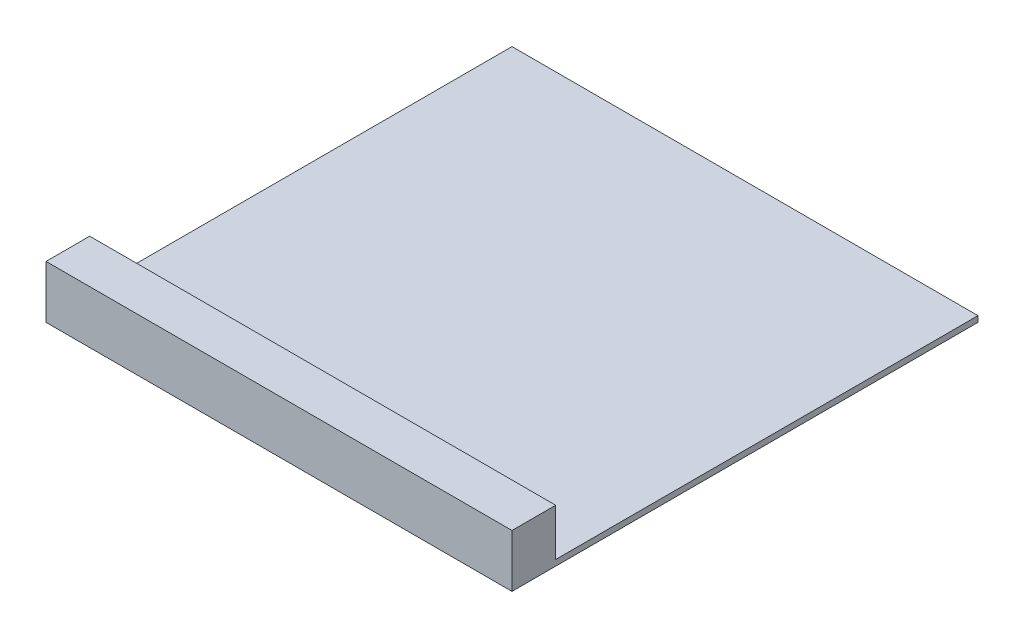
from build123d import *

# Parameters (mm, degrees)
SKETCH1_W           = 128
SKETCH1_H           = 128
BOSS_EXTRUDE1_DEPTH = 14.5
SKETCH2_W           = 128
SKETCH2_H           = 116
CUT_EXTRUDE1_DEPTH  = 12.9


with BuildPart() as part:
    # Sketch1 → Boss-Extrude1 (new body)
    with BuildSketch(Plane(origin=(0, 0, 0), x_dir=(1, 0, 0), z_dir=(0, 1, 0))):
        Rectangle(SKETCH1_W, SKETCH1_H)
    extrude(amount=BOSS_EXTRUDE1_DEPTH)

    # Sketch2 → Cut-Extrude1 (cut)
    with BuildSketch(Plane(origin=(0, 14.5, 0), x_dir=(1, 0, 0), z_dir=(0, 1, 0))):
        with Locations((0, 6)):
            Rectangle(SKETCH2_W, SKETCH2_H)
    extrude(amount=-CUT_EXTRUDE1_DEPTH, mode=Mode.SUBTRACT)


solid = part.part
